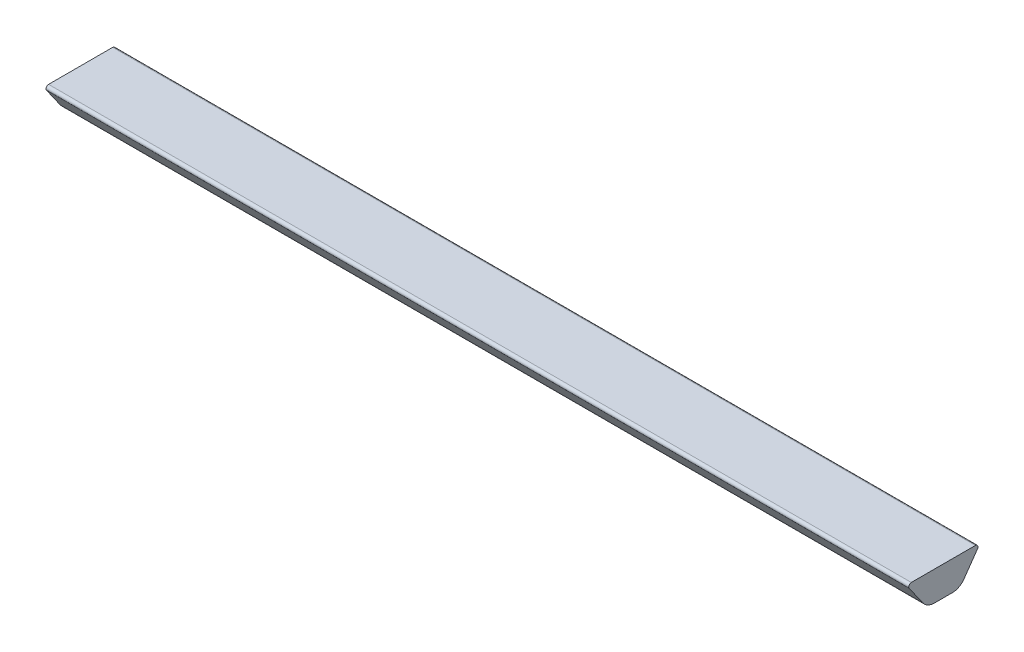
from build123d import *

# Parameters (mm, degrees)
BOSS_EXTRUDE1_DEPTH = 170.165700006
FILLET1_R           = 0.508
FILLET2_R           = 2.794


with BuildPart() as part:
    # Sketch1 → Boss-Extrude1 (new body)
    with BuildSketch(Plane(origin=(0, 0, 0), x_dir=(0, 0, -1), z_dir=(1, 0, 0))):
        Polygon((0.09779276, -0.0508), (14.70220724, -0.0508), (10.623611135, -5.8542), (4.176388865, -5.8542), align=None)
    extrude(amount=BOSS_EXTRUDE1_DEPTH)

    # Fillet1
    fillet1_edges = [part.edges().sort_by_distance(p)[0] for p in [
        (85.082850003, -0.0508, -0.09779276),
        (85.082850003, -0.0508, -14.70220724),
    ]]
    fillet(fillet1_edges, radius=FILLET1_R)

    # Fillet2
    fillet2_edges = [part.edges().sort_by_distance(p)[0] for p in [
        (85.082850003, -5.8542, -10.623611135),
        (85.082850003, -5.8542, -4.176388865),
    ]]
    fillet(fillet2_edges, radius=FILLET2_R)


solid = part.part
